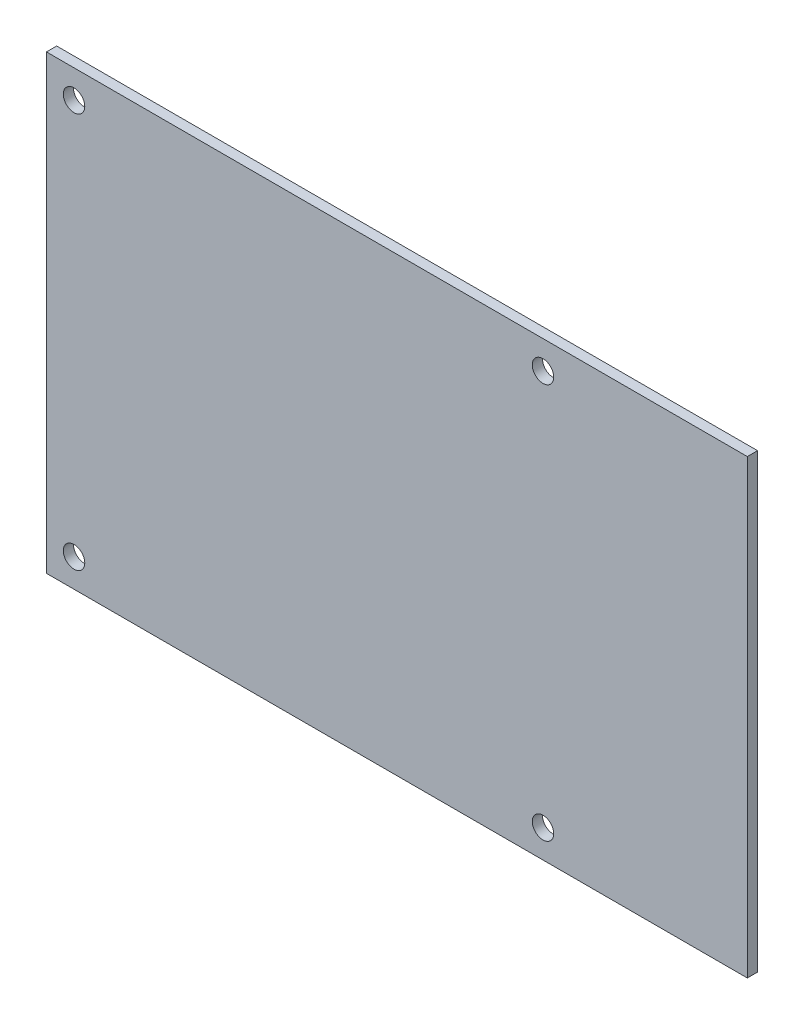
from build123d import *

# Parameters (mm, degrees)
SKETCH1_W           = 87.122
SKETCH1_H           = 56.134
SKETCH1_R           = 1.3335
BOSS_EXTRUDE1_DEPTH = 1.27


with BuildPart() as part:
    # Sketch1 → Boss-Extrude1 (new body)
    with BuildSketch(Plane.XY):
        with Locations((43.561, 28.067)):
            Rectangle(SKETCH1_W, SKETCH1_H)
        with Locations((3.429, 52.6415)):
            Circle(SKETCH1_R, mode=Mode.SUBTRACT)
        with Locations((61.722, 52.6415)):
            Circle(SKETCH1_R, mode=Mode.SUBTRACT)
        with Locations((61.722, 3.4925)):
            Circle(SKETCH1_R, mode=Mode.SUBTRACT)
        with Locations((3.429, 3.4925)):
            Circle(SKETCH1_R, mode=Mode.SUBTRACT)
    extrude(amount=BOSS_EXTRUDE1_DEPTH)


solid = part.part
